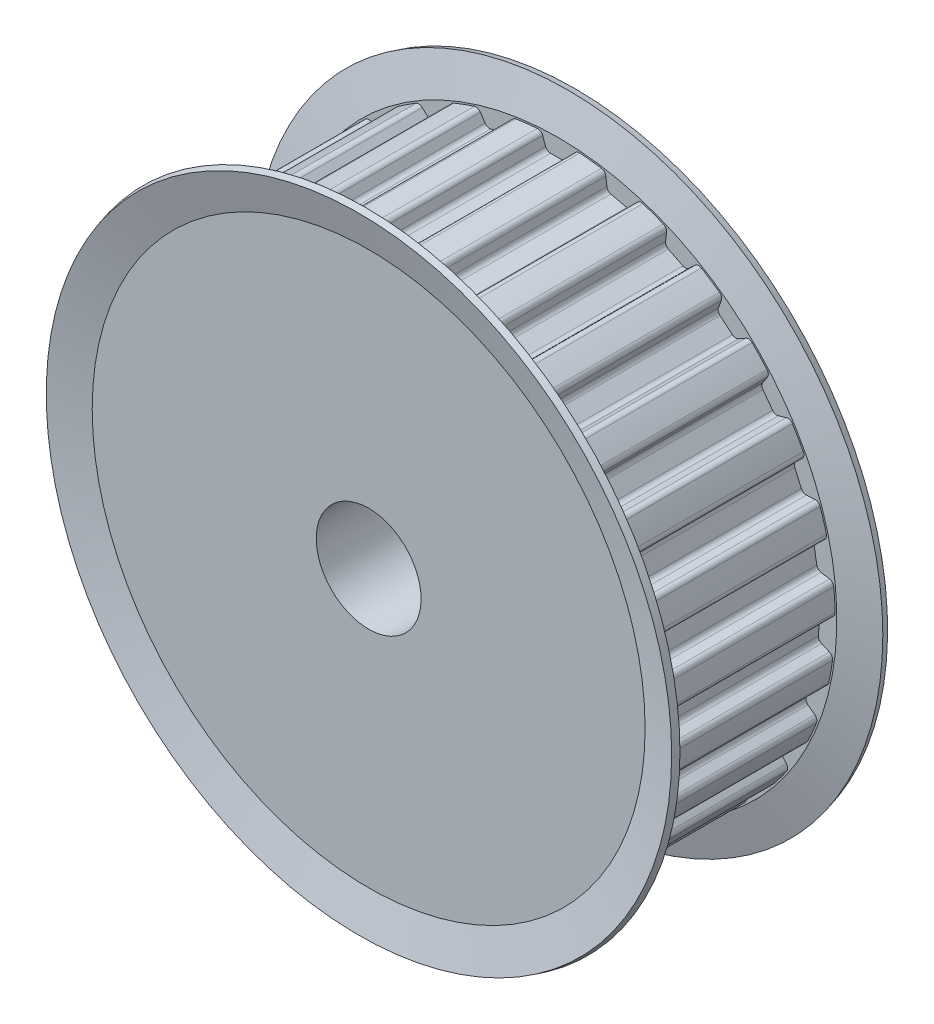
from build123d import *

# Parameters (mm, degrees)
SKETCH5_W           = 15
SKETCH5_H           = 21.1
SKETCH16_W          = 6
SKETCH16_H          = 15
SKETCH17_W          = 21
SKETCH17_H          = 4
CUT_TOOTH_REACH     = 38.489
PATTERN_TOOTH_COUNT = 27


with BuildPart() as part:
    # Sketch5 → body (revolve)
    with BuildSketch(Plane(origin=(0, 0, 0), x_dir=(0, 0, -1), z_dir=(1, 0, 0))):
        with Locations((7.5, 10.55)):
            Rectangle(SKETCH5_W, SKETCH5_H)
    revolve(axis=Axis((0, 0, 0), (0, 0, -1)))

    # Sketch16 → body-hub (revolve)
    with BuildSketch(Plane(origin=(0, 0, 0), x_dir=(0, 0, -1), z_dir=(1, 0, 0))):
        with Locations((18, 7.5)):
            Rectangle(SKETCH16_W, SKETCH16_H)
    revolve(axis=Axis((0, 0, -21), (0, 0, 1)))

    # Sketch17 → body-bore (revolve, cut)
    with BuildSketch(Plane(origin=(0, 0, 0), x_dir=(0, 0, -1), z_dir=(1, 0, 0))):
        with Locations((10.5, 2)):
            Rectangle(SKETCH17_W, SKETCH17_H)
    revolve(axis=Axis((0, 0, -21), (0, 0, 1)), mode=Mode.SUBTRACT)

    # Sketch23 → cut-tooth (cut, up to next)
    with BuildSketch(Plane.XY, mode=Mode.PRIVATE) as cut_tooth_sk1:
        with BuildLine():
            Line((1.625274053, 22.237311716), (-1.625274053, 22.237311716))
            Line((-1.625274053, 22.237311716), (-1.625274053, 21.037311716))
            ThreePointArc((-1.625274053, 21.037311716), (-1.377831852, 20.974760245), (-1.218586122, 20.775308177))
            Line((-1.218586122, 20.775308177), (-0.995794033, 20.163191943))
            ThreePointArc((-0.995794033, 20.163191943), (-0.849347559, 19.972339182), (-0.619916985, 19.9))
            Line((-0.619916985, 19.9), (0.619916985, 19.9))
            ThreePointArc((0.619916985, 19.9), (0.849347559, 19.972339182), (0.995794033, 20.163191943))
            Line((0.995794033, 20.163191943), (1.218586122, 20.775308177))
            ThreePointArc((1.218586122, 20.775308177), (1.377831852, 20.974760245), (1.625274053, 21.037311716))
            Line((1.625274053, 21.037311716), (1.625274053, 22.237311716))
        make_face()
    cut_tooth_tool1 = extrude(cut_tooth_sk1.sketch, amount=-CUT_TOOTH_REACH, mode=Mode.PRIVATE) & part.part
    cut_tooth = cut_tooth_tool1.solids().sort_by_distance((0, 21.197352, 0))[0]
    add(cut_tooth, mode=Mode.SUBTRACT)

    # pattern-tooth: cut-tooth ×27 about axis
    pattern_tooth_axis = Axis((0, 0, -15), (0, 0, 1))
    for i in range(1, PATTERN_TOOTH_COUNT):
        add(cut_tooth.rotate(pattern_tooth_axis, i * 360 / PATTERN_TOOTH_COUNT), mode=Mode.SUBTRACT)

    # Sketch25 → body-flange-front (revolve)
    with BuildSketch(Plane(origin=(0, 0, 0), x_dir=(0, 0, -1), z_dir=(1, 0, 0))):
        Polygon((0.5, 18.905), (0, 18.905), (0, 21.1), (-0.741154273, 23.866025404), (-0.241154273, 24), (0.5, 21.233974596), align=None)
    revolve(axis=Axis((0, 0, 0), (0, 0, -1)))

    # Sketch26 → body-flange-back (revolve)
    with BuildSketch(Plane(origin=(0, 0, 0), x_dir=(0, 0, -1), z_dir=(1, 0, 0))):
        Polygon((14.5, 18.905), (15, 18.905), (15, 21.1), (15.741154273, 23.866025404), (15.241154273, 24), (14.5, 21.233974596), align=None)
    revolve(axis=Axis((0, 0, -15), (0, 0, 1)))


solid = part.part
